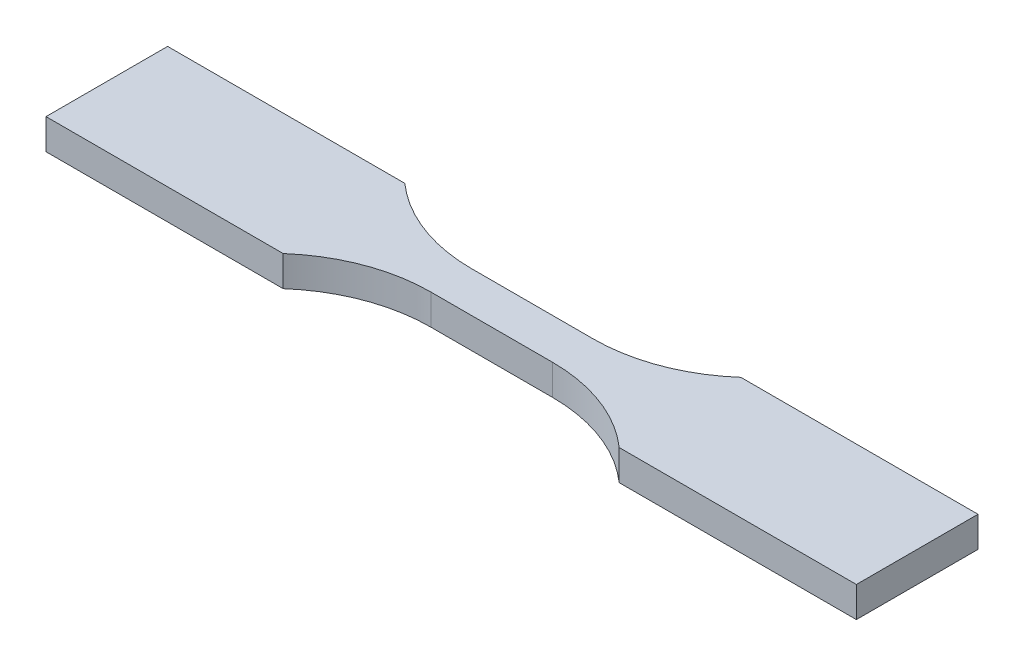
from build123d import *

# Parameters (mm, degrees)
BOSS_EXTRUDE1_DEPTH                      = 2.385
MIRROR1_AT_THE_SECOND_PLANE_COPY_1_DEPTH = 2.385
SCALE1_SCALE                             = 0.3144


with BuildPart() as part:
    # Sketch1 → Boss-Extrude1 (new body)
    with BuildSketch(Plane(origin=(0, 0, 0), x_dir=(1, 0, 0), z_dir=(0, 1, 0))):
        with BuildLine():
            Line((0, 1.59), (4.765, 1.59))
            ThreePointArc((4.765, 1.59), (9.255128061, 2.410237797), (13.165260413, 4.765))
            Line((13.165260413, 4.765), (31.75, 4.765))
            Line((31.75, 4.765), (31.75, 0))
            Line((31.75, 0), (0, 0))
            Line((0, 0), (0, 1.59))
        make_face()
    boss_extrude1 = extrude(amount=BOSS_EXTRUDE1_DEPTH)



with BuildPart() as mirror1_1:
    # Mirror1: Boss-Extrude1 across plane
    add(boss_extrude1.mirror(Plane(origin=(0, 0, 0), x_dir=(0, 0, 1), z_dir=(1, 0, 0))))


with BuildPart() as part_1:
    add(part.part)

    add(mirror1_1.part)  # Mirror1 at the second plane merges Mirror1_1
    # Mirror1 at the second plane: Boss-Extrude1 across plane
    add(boss_extrude1.mirror(Plane.XY))

    # Mirror1 at the second plane copy 1 sketc → Mirror1 at the second plane copy 1 (add)
    with BuildSketch(Plane(origin=(0, 0, 0), x_dir=(-1, 0, 0), z_dir=(0, 1, 0))):
        with BuildLine():
            Line((0, 1.59), (4.765, 1.59))
            ThreePointArc((4.765, 1.59), (9.255128061, 2.410237797), (13.165260413, 4.765))
            Line((13.165260413, 4.765), (31.75, 4.765))
            Line((31.75, 4.765), (31.75, 0))
            Line((31.75, 0), (0, 0))
            Line((0, 0), (0, 1.59))
        make_face()
    extrude(amount=MIRROR1_AT_THE_SECOND_PLANE_COPY_1_DEPTH)


with BuildPart() as part_2:
    # Scale1: scaled about (0, 1.1925, 0)
    add(part_1.part.scale(SCALE1_SCALE).moved(Location((0, 0.817578, 0))))


solid = part_2.part
